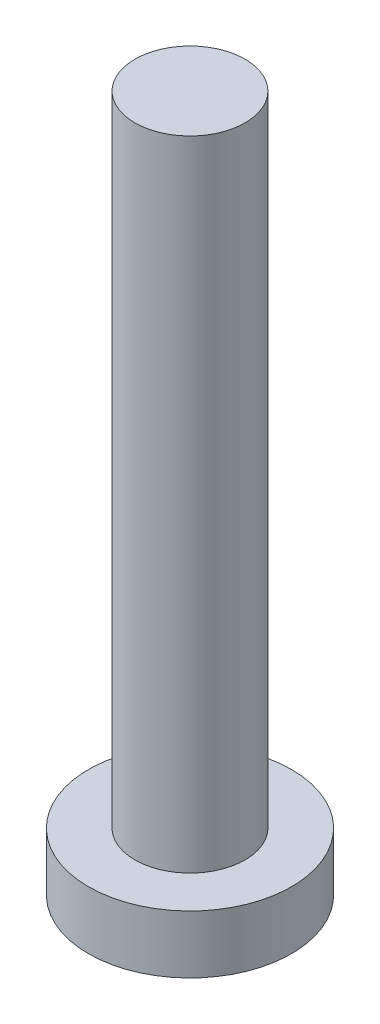
from build123d import *

# Parameters (mm, degrees)
SKETCH1_R           = 1.75
BOSS_EXTRUDE1_DEPTH = 1
SKETCH1_4_R         = 0.95
BOSS_EXTRUDE2_DEPTH = 11


with BuildPart() as part:
    # Sketch1 → Boss-Extrude1 (new body)
    with BuildSketch(Plane(origin=(0, 0, 0), x_dir=(1, 0, 0), z_dir=(0, 1, 0))):
        Circle(SKETCH1_R)
    extrude(amount=-BOSS_EXTRUDE1_DEPTH)

    # Sketch1<4> → Boss-Extrude2 (add)
    with BuildSketch(Plane(origin=(0, 0, 0), x_dir=(1, 0, 0), z_dir=(0, 1, 0))):
        Circle(SKETCH1_4_R)
    extrude(amount=BOSS_EXTRUDE2_DEPTH)


solid = part.part
